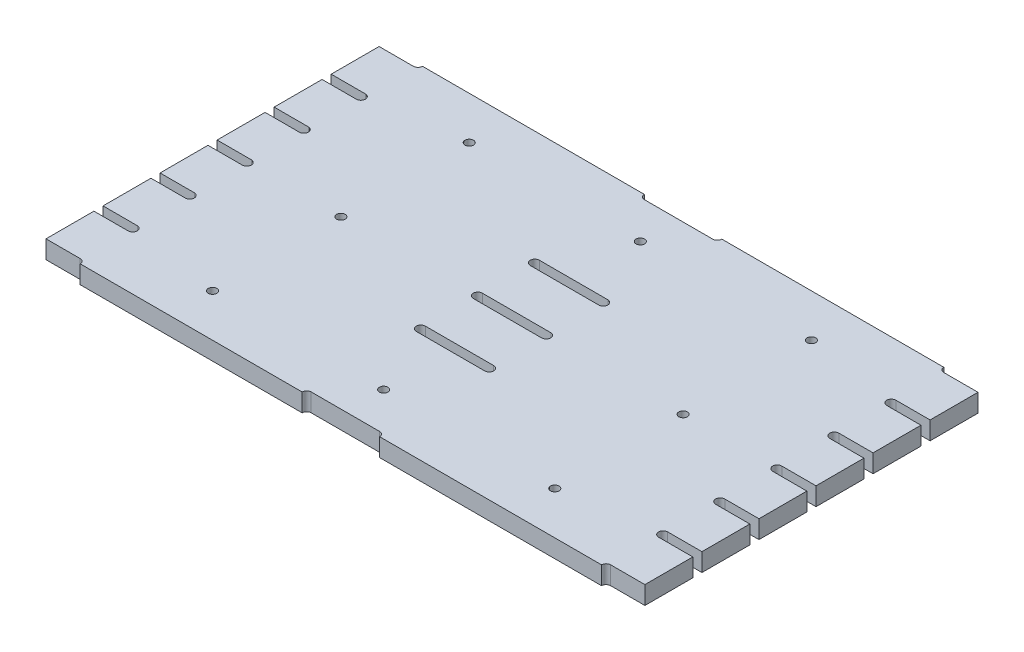
from build123d import *

# Parameters (mm, degrees)
SKETCH1_W                  = 210
SKETCH1_H                  = 120
BOSS_EXTRUDE1_DEPTH        = 6.35
CUT_EXTRUDE1_DEPTH         = 122.100464491
LPATTERN1_COUNT            = 4
LPATTERN1_PITCH            = 20
LPATTERN1_COL_COUNT        = 4
LPATTERN1_COL_PITCH        = 20
LPATTERN2_COUNT            = 2
LPATTERN2_PITCH            = 105
LPATTERN2_COPY_1_DEPTH     = 122.100464491
LPATTERN2_COPY_2_DEPTH     = 122.100464491
LPATTERN2_COPY_3_DEPTH     = 122.100464491
LPATTERN2_COPY_4_DEPTH     = 122.100464491
LPATTERN2_COPY_5_DEPTH     = 122.100464491
LPATTERN2_COPY_6_DEPTH     = 122.100464491
LPATTERN2_COL_COUNT        = 2
LPATTERN2_COL_PITCH        = 105
LPATTERN2_COL_COPY_1_DEPTH = 122.100464491
LPATTERN2_COL_COPY_2_DEPTH = 122.100464491
LPATTERN2_COL_COPY_3_DEPTH = 122.100464491
LPATTERN2_COL_COPY_4_DEPTH = 122.100464491
LPATTERN2_COL_COPY_5_DEPTH = 122.100464491
LPATTERN2_COL_COPY_6_DEPTH = 122.100464491
SKETCH6_R                  = 1.5
CUT_EXTRUDE3_DEPTH         = 10
SKETCH7_R                  = 1.5
CUT_EXTRUDE4_DEPTH         = 10
BOSS_EXTRUDE2_DEPTH        = 6.35


with BuildPart() as part:
    # Sketch1 → Boss-Extrude1 (new body)
    with BuildSketch(Plane(origin=(0, 0, 0), x_dir=(1, 0, 0), z_dir=(0, 1, 0))):
        Rectangle(SKETCH1_W, SKETCH1_H)
    extrude(amount=BOSS_EXTRUDE1_DEPTH)

    # Sketch3 → Cut-Extrude1 (cut, symmetric)
    with BuildSketch(Plane(origin=(0, 6.35, 0), x_dir=(1, 0, 0), z_dir=(0, 1, 0))):
        with BuildLine():
            Line((12, -1.6), (-12, -1.6))
            ThreePointArc((-12, -1.6), (-13.6, 0), (-12, 1.6))
            Line((-12, 1.6), (12, 1.6))
            ThreePointArc((12, 1.6), (13.6, 0), (12, -1.6))
        make_face()
    cut_extrude1 = extrude(amount=CUT_EXTRUDE1_DEPTH, both=True, mode=Mode.SUBTRACT)

    # LPattern1: Cut-Extrude1 ×4
    with Locations(*[(0, 0, i * LPATTERN1_PITCH) for i in range(1, LPATTERN1_COUNT)]):
        add(cut_extrude1, mode=Mode.SUBTRACT)

    # LPattern1 col: Cut-Extrude1 ×4
    with Locations(*[(0, 0, -i * LPATTERN1_COL_PITCH) for i in range(1, LPATTERN1_COL_COUNT)]):
        add(cut_extrude1, mode=Mode.SUBTRACT)

    # LPattern2: Cut-Extrude1 ×2
    with Locations(*[(i * LPATTERN2_PITCH, 0, 0) for i in range(1, LPATTERN2_COUNT)]):
        add(cut_extrude1, mode=Mode.SUBTRACT)

    # LPattern2 copy 1 sketch → LPattern2 copy 1 (cut, symmetric)
    with BuildSketch(Plane(origin=(105, 6.35, 20), x_dir=(1, 0, 0), z_dir=(0, 1, 0))):
        with BuildLine():
            Line((12, -1.6), (-12, -1.6))
            ThreePointArc((-12, -1.6), (-13.6, 0), (-12, 1.6))
            Line((-12, 1.6), (12, 1.6))
            ThreePointArc((12, 1.6), (13.6, 0), (12, -1.6))
        make_face()
    extrude(amount=LPATTERN2_COPY_1_DEPTH, both=True, mode=Mode.SUBTRACT)

    # LPattern2 copy 2 sketch → LPattern2 copy 2 (cut, symmetric)
    with BuildSketch(Plane(origin=(105, 6.35, 40), x_dir=(1, 0, 0), z_dir=(0, 1, 0))):
        with BuildLine():
            Line((12, -1.6), (-12, -1.6))
            ThreePointArc((-12, -1.6), (-13.6, 0), (-12, 1.6))
            Line((-12, 1.6), (12, 1.6))
            ThreePointArc((12, 1.6), (13.6, 0), (12, -1.6))
        make_face()
    extrude(amount=LPATTERN2_COPY_2_DEPTH, both=True, mode=Mode.SUBTRACT)

    # LPattern2 copy 3 sketch → LPattern2 copy 3 (cut, symmetric)
    with BuildSketch(Plane(origin=(105, 6.35, 60), x_dir=(1, 0, 0), z_dir=(0, 1, 0))):
        with BuildLine():
            Line((12, -1.6), (-12, -1.6))
            ThreePointArc((-12, -1.6), (-13.6, 0), (-12, 1.6))
            Line((-12, 1.6), (12, 1.6))
            ThreePointArc((12, 1.6), (13.6, 0), (12, -1.6))
        make_face()
    extrude(amount=LPATTERN2_COPY_3_DEPTH, both=True, mode=Mode.SUBTRACT)

    # LPattern2 copy 4 sketch → LPattern2 copy 4 (cut, symmetric)
    with BuildSketch(Plane(origin=(105, 6.35, -20), x_dir=(1, 0, 0), z_dir=(0, 1, 0))):
        with BuildLine():
            Line((12, -1.6), (-12, -1.6))
            ThreePointArc((-12, -1.6), (-13.6, 0), (-12, 1.6))
            Line((-12, 1.6), (12, 1.6))
            ThreePointArc((12, 1.6), (13.6, 0), (12, -1.6))
        make_face()
    extrude(amount=LPATTERN2_COPY_4_DEPTH, both=True, mode=Mode.SUBTRACT)

    # LPattern2 copy 5 sketch → LPattern2 copy 5 (cut, symmetric)
    with BuildSketch(Plane(origin=(105, 6.35, -40), x_dir=(1, 0, 0), z_dir=(0, 1, 0))):
        with BuildLine():
            Line((12, -1.6), (-12, -1.6))
            ThreePointArc((-12, -1.6), (-13.6, 0), (-12, 1.6))
            Line((-12, 1.6), (12, 1.6))
            ThreePointArc((12, 1.6), (13.6, 0), (12, -1.6))
        make_face()
    extrude(amount=LPATTERN2_COPY_5_DEPTH, both=True, mode=Mode.SUBTRACT)

    # LPattern2 copy 6 sketch → LPattern2 copy 6 (cut, symmetric)
    with BuildSketch(Plane(origin=(105, 6.35, -60), x_dir=(1, 0, 0), z_dir=(0, 1, 0))):
        with BuildLine():
            Line((12, -1.6), (-12, -1.6))
            ThreePointArc((-12, -1.6), (-13.6, 0), (-12, 1.6))
            Line((-12, 1.6), (12, 1.6))
            ThreePointArc((12, 1.6), (13.6, 0), (12, -1.6))
        make_face()
    extrude(amount=LPATTERN2_COPY_6_DEPTH, both=True, mode=Mode.SUBTRACT)

    # LPattern2 col: Cut-Extrude1 ×2
    with Locations(*[(-i * LPATTERN2_COL_PITCH, 0, 0) for i in range(1, LPATTERN2_COL_COUNT)]):
        add(cut_extrude1, mode=Mode.SUBTRACT)

    # LPattern2 col copy 1 sketch → LPattern2 col copy 1 (cut, symmetric)
    with BuildSketch(Plane(origin=(-105, 6.35, 20), x_dir=(1, 0, 0), z_dir=(0, 1, 0))):
        with BuildLine():
            Line((12, -1.6), (-12, -1.6))
            ThreePointArc((-12, -1.6), (-13.6, 0), (-12, 1.6))
            Line((-12, 1.6), (12, 1.6))
            ThreePointArc((12, 1.6), (13.6, 0), (12, -1.6))
        make_face()
    extrude(amount=LPATTERN2_COL_COPY_1_DEPTH, both=True, mode=Mode.SUBTRACT)

    # LPattern2 col copy 2 sketch → LPattern2 col copy 2 (cut, symmetric)
    with BuildSketch(Plane(origin=(-105, 6.35, 40), x_dir=(1, 0, 0), z_dir=(0, 1, 0))):
        with BuildLine():
            Line((12, -1.6), (-12, -1.6))
            ThreePointArc((-12, -1.6), (-13.6, 0), (-12, 1.6))
            Line((-12, 1.6), (12, 1.6))
            ThreePointArc((12, 1.6), (13.6, 0), (12, -1.6))
        make_face()
    extrude(amount=LPATTERN2_COL_COPY_2_DEPTH, both=True, mode=Mode.SUBTRACT)

    # LPattern2 col copy 3 sketch → LPattern2 col copy 3 (cut, symmetric)
    with BuildSketch(Plane(origin=(-105, 6.35, 60), x_dir=(1, 0, 0), z_dir=(0, 1, 0))):
        with BuildLine():
            Line((12, -1.6), (-12, -1.6))
            ThreePointArc((-12, -1.6), (-13.6, 0), (-12, 1.6))
            Line((-12, 1.6), (12, 1.6))
            ThreePointArc((12, 1.6), (13.6, 0), (12, -1.6))
        make_face()
    extrude(amount=LPATTERN2_COL_COPY_3_DEPTH, both=True, mode=Mode.SUBTRACT)

    # LPattern2 col copy 4 sketch → LPattern2 col copy 4 (cut, symmetric)
    with BuildSketch(Plane(origin=(-105, 6.35, -20), x_dir=(1, 0, 0), z_dir=(0, 1, 0))):
        with BuildLine():
            Line((12, -1.6), (-12, -1.6))
            ThreePointArc((-12, -1.6), (-13.6, 0), (-12, 1.6))
            Line((-12, 1.6), (12, 1.6))
            ThreePointArc((12, 1.6), (13.6, 0), (12, -1.6))
        make_face()
    extrude(amount=LPATTERN2_COL_COPY_4_DEPTH, both=True, mode=Mode.SUBTRACT)

    # LPattern2 col copy 5 sketch → LPattern2 col copy 5 (cut, symmetric)
    with BuildSketch(Plane(origin=(-105, 6.35, -40), x_dir=(1, 0, 0), z_dir=(0, 1, 0))):
        with BuildLine():
            Line((12, -1.6), (-12, -1.6))
            ThreePointArc((-12, -1.6), (-13.6, 0), (-12, 1.6))
            Line((-12, 1.6), (12, 1.6))
            ThreePointArc((12, 1.6), (13.6, 0), (12, -1.6))
        make_face()
    extrude(amount=LPATTERN2_COL_COPY_5_DEPTH, both=True, mode=Mode.SUBTRACT)

    # LPattern2 col copy 6 sketch → LPattern2 col copy 6 (cut, symmetric)
    with BuildSketch(Plane(origin=(-105, 6.35, -60), x_dir=(1, 0, 0), z_dir=(0, 1, 0))):
        with BuildLine():
            Line((12, -1.6), (-12, -1.6))
            ThreePointArc((-12, -1.6), (-13.6, 0), (-12, 1.6))
            Line((-12, 1.6), (12, 1.6))
            ThreePointArc((12, 1.6), (13.6, 0), (12, -1.6))
        make_face()
    extrude(amount=LPATTERN2_COL_COPY_6_DEPTH, both=True, mode=Mode.SUBTRACT)

    # Sketch6 → Cut-Extrude3 (cut)
    with BuildSketch(Plane(origin=(0, 6.35, 0), x_dir=(1, 0, 0), z_dir=(0, 1, 0))):
        with Locations(Location((-60, 45, 0), (0, 0, 270))):
            Circle(SKETCH6_R)
        with Locations(Location((60, 45, 0), (0, 0, 270))):
            Circle(SKETCH6_R)
        with Locations(Location((60, -45, 0), (0, 0, 270))):
            Circle(SKETCH6_R)
        with Locations(Location((-60, -45, 0), (0, 0, 270))):
            Circle(SKETCH6_R)
        with Locations(Location((0, 45, 0), (0, 0, 270))):
            Circle(SKETCH6_R)
        with Locations(Location((0, -45, 0), (0, 0, 270))):
            Circle(SKETCH6_R)
    extrude(amount=-CUT_EXTRUDE3_DEPTH, mode=Mode.SUBTRACT)

    # Sketch7 → Cut-Extrude4 (cut)
    with BuildSketch(Plane(origin=(0, 6.35, 0), x_dir=(1, 0, 0), z_dir=(0, 1, 0))):
        with Locations(Location((-60, 0, 0), (0, 0, 270))):
            Circle(SKETCH7_R)
        with Locations(Location((60, 0, 0), (0, 0, 270))):
            Circle(SKETCH7_R)
    extrude(amount=-CUT_EXTRUDE4_DEPTH, mode=Mode.SUBTRACT)

    # Sketch8 → Boss-Extrude2 (add)
    with BuildSketch(Plane(origin=(0, 6.35, 0), x_dir=(1, 0, 0), z_dir=(0, 1, 0))):
        with BuildLine():
            Line((-12, 42), (12, 42))
            ThreePointArc((12, 42), (14, 40), (12, 38))
            Line((12, 38), (-12, 38))
            ThreePointArc((-12, 38), (-14, 40), (-12, 42))
        make_face()
        with BuildLine():
            Line((-12, -38), (12, -38))
            ThreePointArc((12, -38), (14, -40), (12, -42))
            Line((12, -42), (-12, -42))
            ThreePointArc((-12, -42), (-14, -40), (-12, -38))
        make_face()
    extrude(amount=-BOSS_EXTRUDE2_DEPTH)


solid = part.part
